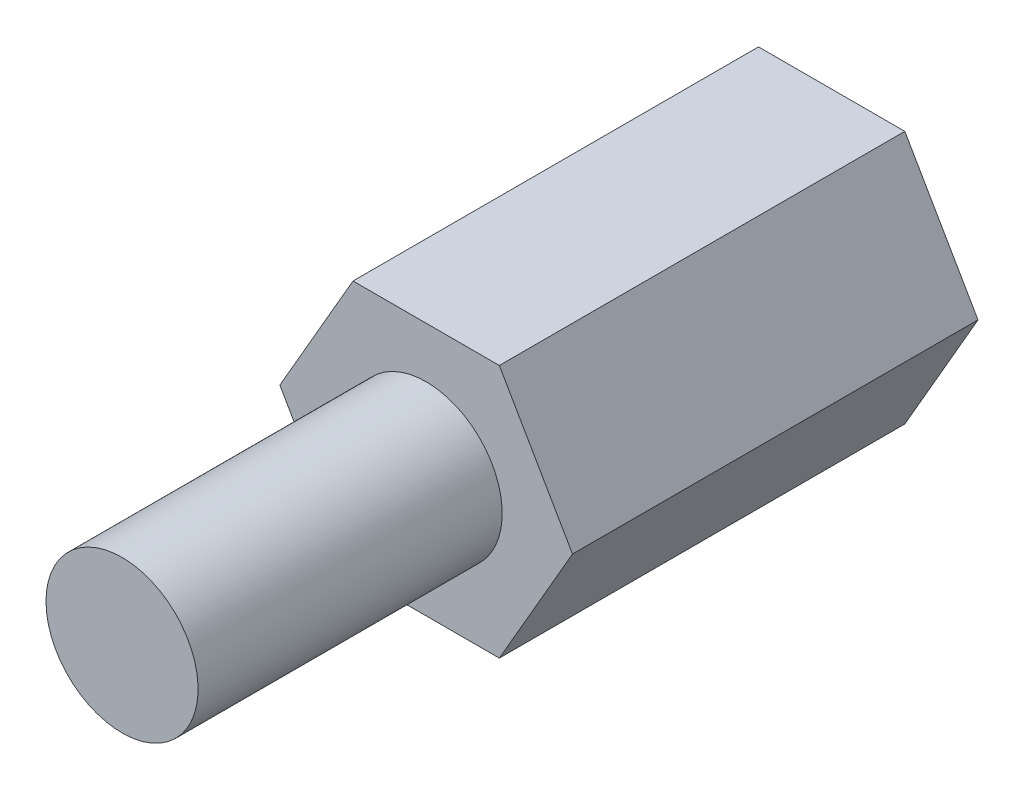
from build123d import *

# Parameters (mm, degrees)
EXTRUDE_1_DEPTH = 8
SKETCH_2_R      = 1.5
EXTRUDE_2_DEPTH = 6
M3X0_5_1_D      = 2.5
M3X0_5_1_DEPTH  = 6.5
M3X0_5_1_TIP    = 0.751075774


with BuildPart() as part:
    # 草图1 → 拉伸1 (new body)
    with BuildSketch(Plane.XY):
        Polygon((1.443375673, -2.5), (2.886751346, 0), (1.443375673, 2.5), (-1.443375673, 2.5), (-2.886751346, 0), (-1.443375673, -2.5), align=None)
    extrude(amount=EXTRUDE_1_DEPTH)

    # 草图2 → 拉伸2 (add)
    with BuildSketch(Plane.XY.offset(8)):
        Circle(SKETCH_2_R)
    extrude(amount=EXTRUDE_2_DEPTH)

    # M3x0.5 螺纹孔1
    with Locations(Plane(origin=(0, 0, 0), x_dir=(-1, 0, 0), z_dir=(0, 0, -1))):
        with Locations((0, 0)):
            Hole(M3X0_5_1_D / 2, depth=M3X0_5_1_DEPTH)
            with Locations((0, 0, -(M3X0_5_1_DEPTH + M3X0_5_1_TIP / 2))):  # 118° drill point
                Cone(0, M3X0_5_1_D / 2, M3X0_5_1_TIP, mode=Mode.SUBTRACT)


solid = part.part
